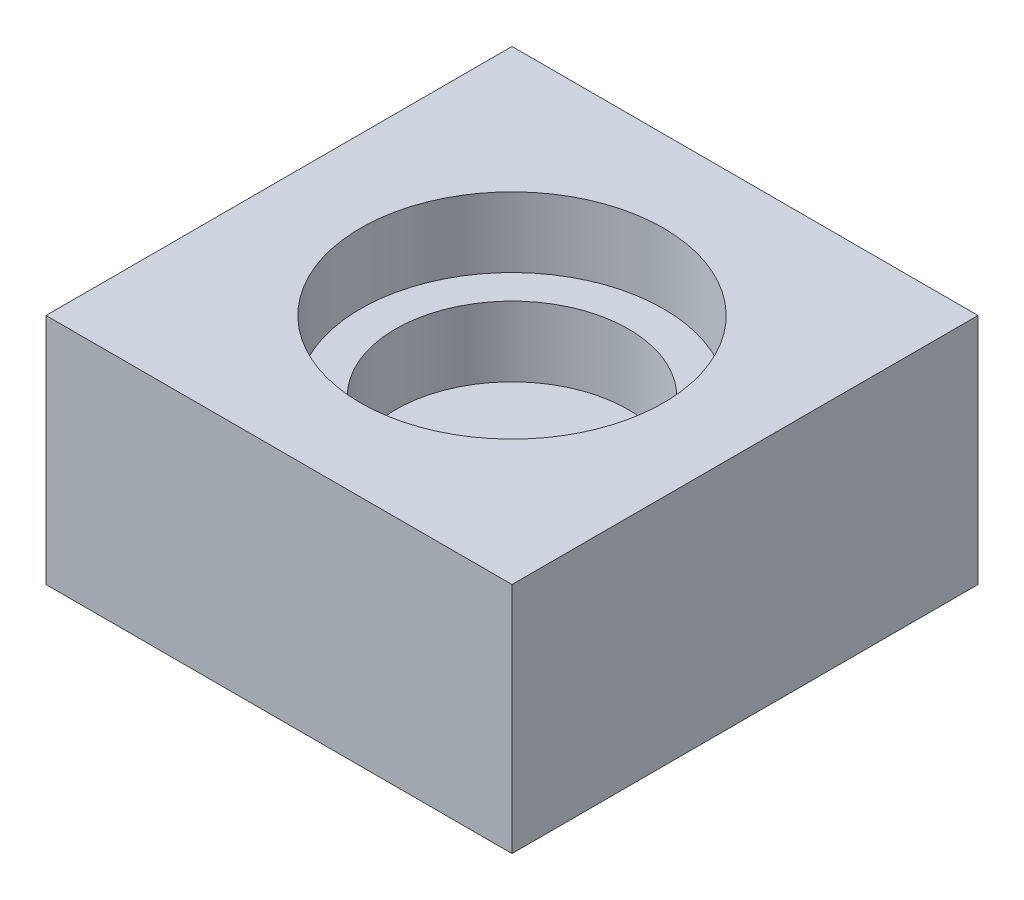
from build123d import *

# Parameters (mm, degrees)
SKETCH_1_W          = 40
SKETCH_1_H          = 40
EXTRUDE_1_DEPTH     = 20
SKETCH_2_R          = 13
CUT_EXTRUDE_1_DEPTH = 6
SKETCH_3_R          = 10
CUT_EXTRUDE_2_DEPTH = 6


with BuildPart() as part:
    # Эскиз1 → Бобышка-Вытянуть1 (new body)
    with BuildSketch(Plane(origin=(0, 0, 0), x_dir=(1, 0, 0), z_dir=(0, 1, 0))):
        with Locations((20, 20)):
            Rectangle(SKETCH_1_W, SKETCH_1_H)
    extrude(amount=EXTRUDE_1_DEPTH)

    # Эскиз2 → Вырез-Вытянуть1 (cut)
    with BuildSketch(Plane(origin=(0, 20, 0), x_dir=(1, 0, 0), z_dir=(0, 1, 0))):
        with Locations(Location((20, 20, 0), (0, 0, 270))):
            Circle(SKETCH_2_R)
    extrude(amount=-CUT_EXTRUDE_1_DEPTH, mode=Mode.SUBTRACT)

    # Эскиз3 → Вырез-Вытянуть2 (cut)
    with BuildSketch(Plane(origin=(0, 14, 0), x_dir=(1, 0, 0), z_dir=(0, 1, 0))):
        with Locations(Location((20, 20, 0), (0, 0, 270))):
            Circle(SKETCH_3_R)
    extrude(amount=-CUT_EXTRUDE_2_DEPTH, mode=Mode.SUBTRACT)


solid = part.part
